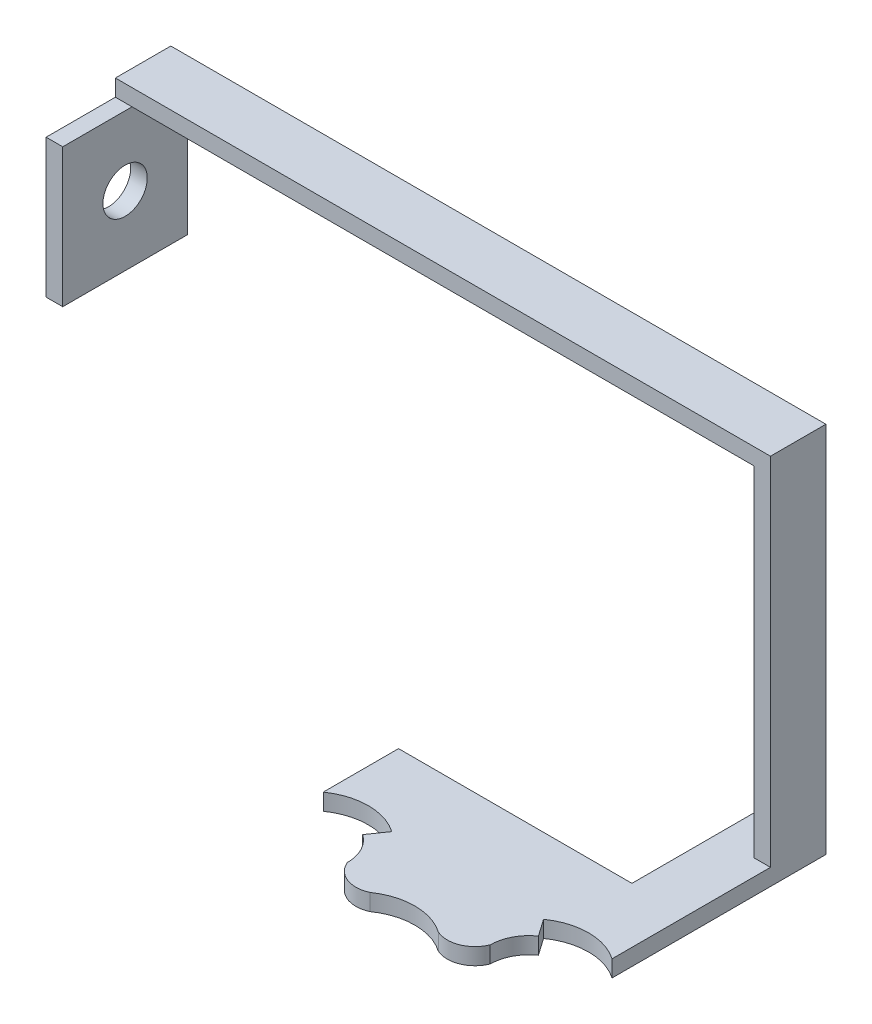
from build123d import *

# Parameters (mm, degrees)
BOSS_EXTRUDE1_DEPTH = 3
SKETCH3_W           = 10
SKETCH3_H           = 3
BOSS_EXTRUDE2_DEPTH = 25
SKETCH5_W           = 3
SKETCH5_H           = 10
BOSS_EXTRUDE4_DEPTH = 64.25
SKETCH7_W           = 10
SKETCH7_H           = 3
BOSS_EXTRUDE5_DEPTH = 115.21
SKETCH8_W           = 3
SKETCH8_H           = 22.5
BOSS_EXTRUDE6_DEPTH = 25
SKETCH10_R          = 4
CUT_EXTRUDE1_DEPTH  = 3


with BuildPart() as part:
    # Sketch2 → Boss-Extrude1 (new body)
    with BuildSketch(Plane(origin=(0, 0, 0), x_dir=(1, 0, 0), z_dir=(0, 1, 0))):
        with BuildLine():
            Line((-15.860247962, 17.20906431), (-13.694996915, 20.301363277))
            ThreePointArc((-13.694996915, 20.301363277), (-19.875283017, 22.25), (-26.055569119, 20.301363277))
            Line((-26.055569119, 20.301363277), (-26.055569119, 33.889213566))
            Line((-26.055569119, 33.889213566), (26.055569119, 33.889213566))
            Line((26.055569119, 33.889213566), (26.055569119, 20.301363277))
            ThreePointArc((26.055569119, 20.301363277), (19.875283017, 22.25), (13.694996915, 20.301363277))
            Line((13.694996915, 20.301363277), (15.860247962, 17.20906431))
            ThreePointArc((15.860247962, 17.20906431), (13.666207185, 14.707240293), (12.875283017, 11.475))
            ThreePointArc((12.875283017, 11.475), (10.090653959, 8.727908609), (6.180286102, 8.826363277))
            ThreePointArc((6.180286102, 8.826363277), (0, 10.775), (-6.180286102, 8.826363277))
            ThreePointArc((-6.180286102, 8.826363277), (-10.090653959, 8.727908609), (-12.875283017, 11.475))
            ThreePointArc((-12.875283017, 11.475), (-13.666207185, 14.707240293), (-15.860247962, 17.20906431))
        make_face()
    extrude(amount=BOSS_EXTRUDE1_DEPTH)

    # Sketch3 → Boss-Extrude2 (add)
    with BuildSketch(Plane(origin=(0, 0, -33.889213566), x_dir=(-1, 0, 0), z_dir=(0, 0, -1))):
        with Locations((-21.055569119, 1.5)):
            Rectangle(SKETCH3_W, SKETCH3_H)
    extrude(amount=BOSS_EXTRUDE2_DEPTH)

    # Sketch5 → Boss-Extrude4 (add)
    with BuildSketch(Plane(origin=(0, 3, 0), x_dir=(1, 0, 0), z_dir=(0, 1, 0))):
        with Locations((24.555569119, 53.889213566)):
            Rectangle(SKETCH5_W, SKETCH5_H)
    extrude(amount=BOSS_EXTRUDE4_DEPTH)

    # Sketch7 → Boss-Extrude5 (add)
    with BuildSketch(Plane.ZY.offset(-23.055569119)):
        with Locations((-53.889213566, 65.75)):
            Rectangle(SKETCH7_W, SKETCH7_H)
    extrude(amount=BOSS_EXTRUDE5_DEPTH)

    # Sketch8 → Boss-Extrude6 (add)
    with BuildSketch(Plane.XZ.offset(-64.25)):
        with Locations((-90.654430881, -47.639213566)):
            Rectangle(SKETCH8_W, SKETCH8_H)
    extrude(amount=BOSS_EXTRUDE6_DEPTH)

    # Sketch10 → Cut-Extrude1 (cut)
    with BuildSketch(Plane.ZY.offset(92.154430881)):
        with Locations((-47.639213566, 51.75)):
            Circle(SKETCH10_R)
    extrude(amount=-CUT_EXTRUDE1_DEPTH, mode=Mode.SUBTRACT)


solid = part.part
